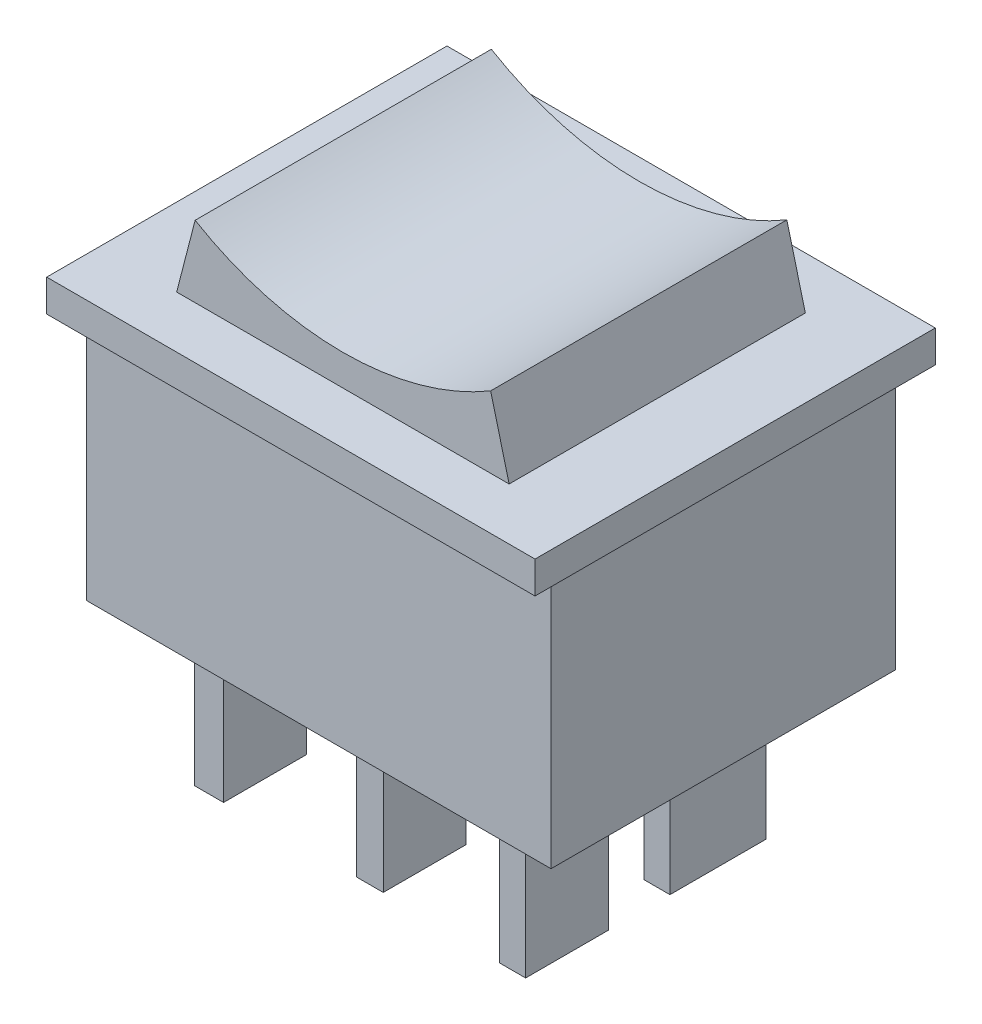
from build123d import *

# Parameters (mm, degrees)
SKETCH_1_W      = 30.5
SKETCH_1_H      = 25
EXTRUDE_1_DEPTH = 2
SKETCH_2_W      = 29
SKETCH_2_H      = 21.5
EXTRUDE_2_DEPTH = 16
SKETCH_3_W      = 1.802565081
SKETCH_3_H      = 5.167353231
SKETCH_3_H_2    = 6.008550268
SKETCH_3_W_2    = 1.682394075
SKETCH_3_H_3    = 6.008550269
SKETCH_3_W_3    = 1.622308572
EXTRUDE_3_DEPTH = 9.6
EXTRUDE_4_DEPTH = 9.25


with BuildPart() as part:
    # 草图1 → 凸台-拉伸1 (new body)
    with BuildSketch(Plane(origin=(0, 0, 0), x_dir=(1, 0, 0), z_dir=(0, 1, 0))):
        Rectangle(SKETCH_1_W, SKETCH_1_H)
    extrude(amount=EXTRUDE_1_DEPTH)

    # 草图2 → 凸台-拉伸2 (add)
    with BuildSketch(Plane.XZ):
        Rectangle(SKETCH_2_W, SKETCH_2_H)
    extrude(amount=EXTRUDE_2_DEPTH)

    # 草图3 → 凸台-拉伸3 (add)
    with BuildSketch(Plane.XZ.offset(16)):
        with Locations((-9.810401899, 5.210817025)):
            Rectangle(SKETCH_3_W, SKETCH_3_H)
        with Locations((-9.810401899, -4.222606897)):
            Rectangle(SKETCH_3_W, SKETCH_3_H_2)
        with Locations((0.103706044, 5.09064602)):
            Rectangle(SKETCH_3_W_2, SKETCH_3_H)
        with Locations((0.103706044, -4.342777902)):
            Rectangle(SKETCH_3_W_2, SKETCH_3_H_3)
        with Locations((9.206659702, 5.270902528)):
            Rectangle(SKETCH_3_W_3, SKETCH_3_H)
        with Locations((9.206659702, -4.162521395)):
            Rectangle(SKETCH_3_W_3, SKETCH_3_H_3)
    extrude(amount=EXTRUDE_3_DEPTH)

    # 草图4 → 凸台-拉伸4 (add, symmetric)
    with BuildSketch(Plane.XY):
        with BuildLine():
            Line((10.382594104, 2), (-10.382594104, 2))
            Line((-10.382594104, 2), (-9.22822883, 6.460566864))
            ThreePointArc((-9.22822883, 6.460566864), (-4.784721142, 4.572616283), (0, 3.927975641))
            ThreePointArc((0, 3.927975641), (4.784721142, 4.572616283), (9.22822883, 6.460566864))
            Line((9.22822883, 6.460566864), (10.382594104, 2))
        make_face()
    extrude(amount=EXTRUDE_4_DEPTH, both=True)


solid = part.part
